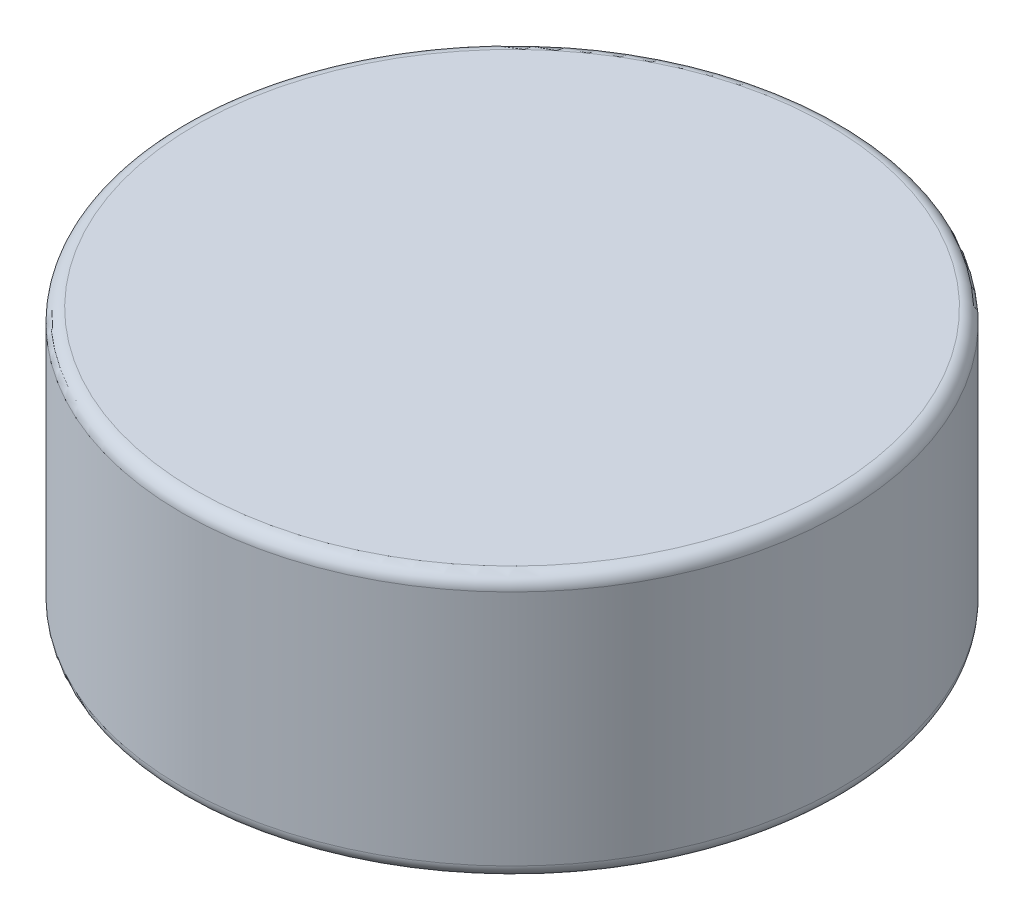
from build123d import *

# Parameters (mm, degrees)
SKETCH1_R           = 25
BOSS_EXTRUDE1_DEPTH = 20
FILLET3_R           = 1
SKETCH2_R           = 3
CUT_EXTRUDE1_DEPTH  = 12.5


with BuildPart() as part:
    # Sketch1 → Boss-Extrude1 (new body)
    with BuildSketch(Plane(origin=(0, 0, 0), x_dir=(1, 0, 0), z_dir=(0, 1, 0))):
        with Locations(Location((0, 0, 0), (0, 0, 270))):
            Circle(SKETCH1_R)
    extrude(amount=-BOSS_EXTRUDE1_DEPTH)

    # Fillet3
    fillet3_edges = [part.edges().sort_by_distance(p)[0] for p in [
        (0, 0, -25),
        (0, -20, -25),
    ]]
    fillet(fillet3_edges, radius=FILLET3_R)

    # Sketch2 → Cut-Extrude1 (cut)
    with BuildSketch(Plane.XZ.offset(20)):
        with Locations(Location((0, 0, 0), (0, 0, 270))):
            Circle(SKETCH2_R)
    extrude(amount=-CUT_EXTRUDE1_DEPTH, mode=Mode.SUBTRACT)


solid = part.part
